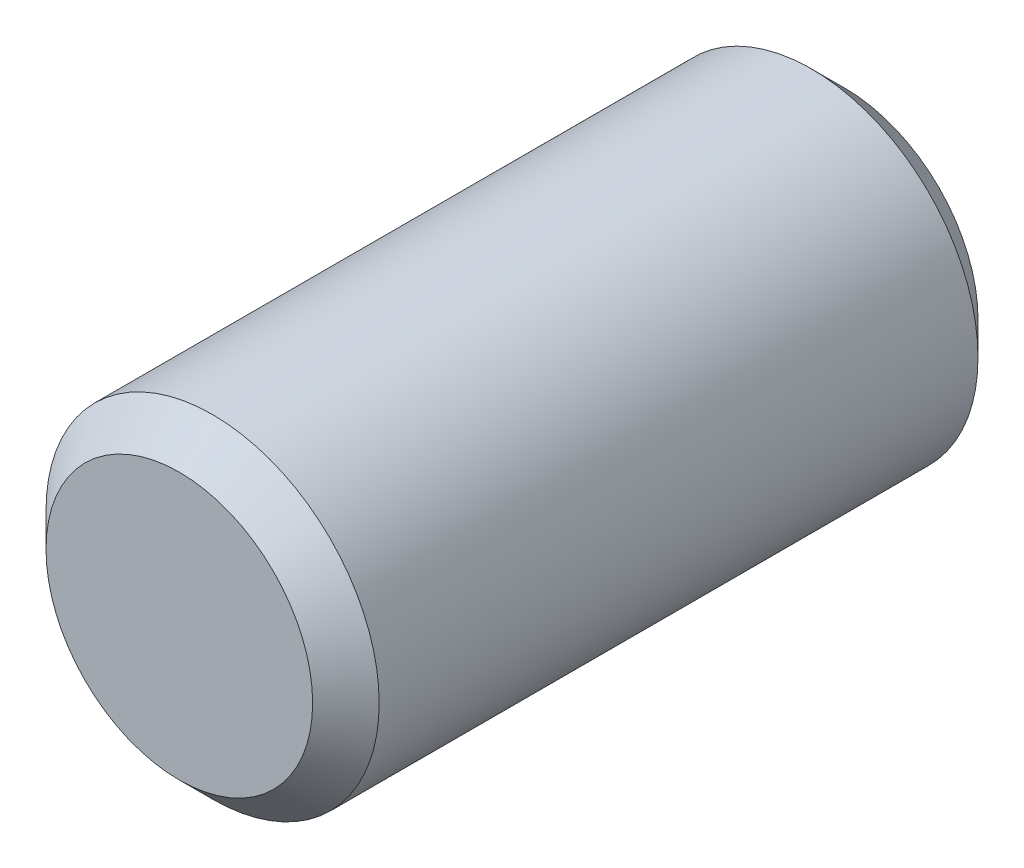
from build123d import *

# Parameters (mm, degrees)
SKETCH1_W     = 20
SKETCH1_H     = 5.0075
CHAMFER1_SIZE = 1


with BuildPart() as part:
    # Sketch1 → Revolve1 (revolve)
    with BuildSketch(Plane(origin=(0, 0, 0), x_dir=(0, 0, -1), z_dir=(1, 0, 0)), mode=Mode.PRIVATE) as revolve1_sk:
        with Locations((10, 2.50375)):
            Rectangle(SKETCH1_W, SKETCH1_H)
    revolve(revolve1_sk.sketch.rotate(Axis((0, 0, 0), (0, 0, -1)), 90), axis=Axis((0, 0, 0), (0, 0, -1)))

    # Chamfer1
    chamfer1_edges = [part.edges().sort_by_distance(p)[0] for p in [
        (-5.0075, 0, -20),
        (-5.0075, 0, 0),
    ]]
    chamfer(chamfer1_edges, length=CHAMFER1_SIZE)


solid = part.part
